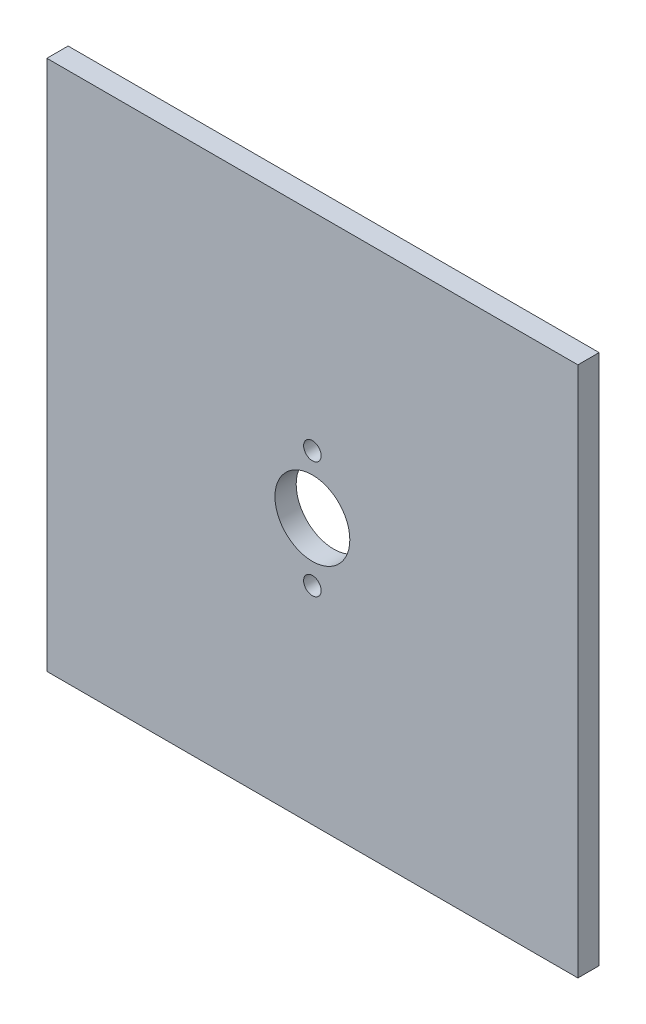
from build123d import *

# Parameters (mm, degrees)
SKETCH4_W           = 50
SKETCH4_H           = 50
BOSS_EXTRUDE2_DEPTH = 2
CUT_EXTRUDE1_REACH  = 72.739
SKETCH5_R           = 0.825
CUT_EXTRUDE2_REACH  = 72.739
SKETCH6_R           = 3.525


with BuildPart() as part:
    # Sketch4 → Boss-Extrude2 (new body)
    with BuildSketch(Plane.XY):
        with Locations((-25, 25)):
            Rectangle(SKETCH4_W, SKETCH4_H)
    extrude(amount=BOSS_EXTRUDE2_DEPTH)

    # Sketch5 → Cut-Extrude1 (cut, up to next)
    with BuildSketch(Plane.XY.offset(2), mode=Mode.PRIVATE) as cut_extrude1_sk1:
        with Locations((-25, 30.5)):
            Circle(SKETCH5_R)
    cut_extrude1_tool1 = extrude(cut_extrude1_sk1.sketch, amount=-CUT_EXTRUDE1_REACH, mode=Mode.PRIVATE) & part.part
    # Sketch5 → Cut-Extrude1 (cut, up to next)
    with BuildSketch(Plane.XY.offset(2), mode=Mode.PRIVATE) as cut_extrude1_sk2:
        with Locations((-25, 19.5)):
            Circle(SKETCH5_R)
    cut_extrude1_tool2 = extrude(cut_extrude1_sk2.sketch, amount=-CUT_EXTRUDE1_REACH, mode=Mode.PRIVATE) & part.part
    add(cut_extrude1_tool1.solids().sort_by_distance((-25, 30.5, 2))[0], mode=Mode.SUBTRACT)
    add(cut_extrude1_tool2.solids().sort_by_distance((-25, 19.5, 2))[0], mode=Mode.SUBTRACT)

    # Sketch6 → Cut-Extrude2 (cut, up to next)
    with BuildSketch(Plane(origin=(0, 0, 0), x_dir=(-1, 0, 0), z_dir=(0, 0, -1)), mode=Mode.PRIVATE) as cut_extrude2_sk1:
        with Locations((25, 25)):
            Circle(SKETCH6_R)
    cut_extrude2_tool1 = extrude(cut_extrude2_sk1.sketch, amount=-CUT_EXTRUDE2_REACH, mode=Mode.PRIVATE) & part.part
    add(cut_extrude2_tool1.solids().sort_by_distance((-25, 25, 0))[0], mode=Mode.SUBTRACT)


solid = part.part
